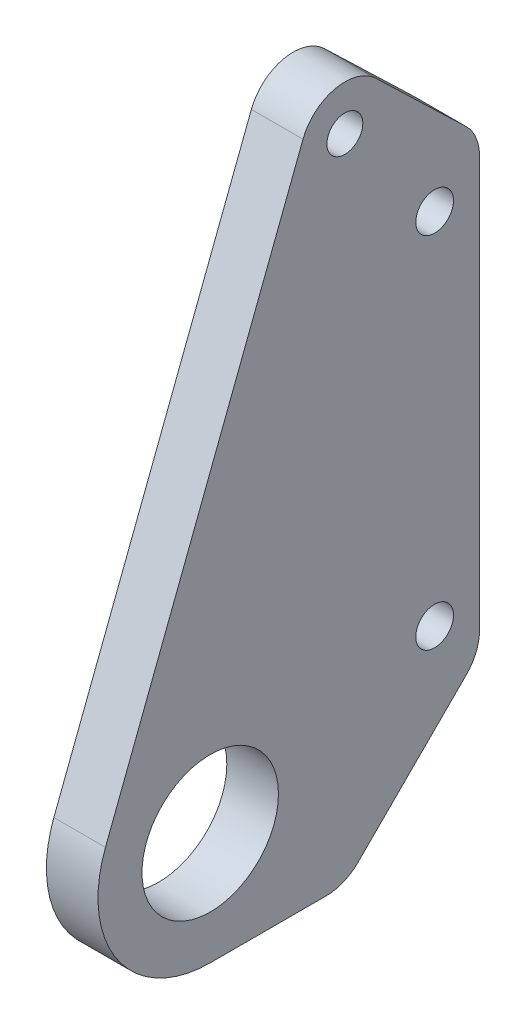
from build123d import *

# Parameters (mm, degrees)
SKETCH_1_R      = 7.6
SKETCH_1_R_2    = 2.1
SKETCH_1_R_3    = 2
EXTRUDE_1_DEPTH = 5.75
FILLET_1_R      = 5


with BuildPart() as part:
    # ｽｹｯﾁ1 → ﾎﾞｽ - 押し出し1 (new body)
    with BuildSketch(Plane(origin=(0, 0, 0), x_dir=(0, 0, -1), z_dir=(1, 0, 0))):
        with BuildLine():
            Line((-15, 0), (0, 15))
            Line((0, 15), (0, 65))
            Line((0, 65), (-11.532291921, 76.102082825))
            ThreePointArc((-11.532291921, 76.102082825), (-16.085919318, 77.380653566), (-19.667854572, 74.291963643))
            Line((-19.667854572, 74.291963643), (-41.669636429, 16.979909107))
            ThreePointArc((-41.669636429, 16.979909107), (-40.301671317, 5.420058752), (-30, 0))
            Line((-30, 0), (-15, 0))
        make_face()
        with Locations((-30, 12.5)):
            Circle(SKETCH_1_R, mode=Mode.SUBTRACT)
        with Locations((-5, 20)):
            Circle(SKETCH_1_R_2, mode=Mode.SUBTRACT)
        with Locations((-5, 60)):
            Circle(SKETCH_1_R_2, mode=Mode.SUBTRACT)
        with Locations((-15, 72.5)):
            Circle(SKETCH_1_R_3, mode=Mode.SUBTRACT)
    extrude(amount=EXTRUDE_1_DEPTH)

    # ﾌｨﾚｯﾄ1
    fillet_1_edges = [part.edges().sort_by_distance(p)[0] for p in [
        (2.875, 65, 0),
        (2.875, 15, 0),
        (2.875, 0, 15),
    ]]
    fillet(fillet_1_edges, radius=FILLET_1_R)


solid = part.part
